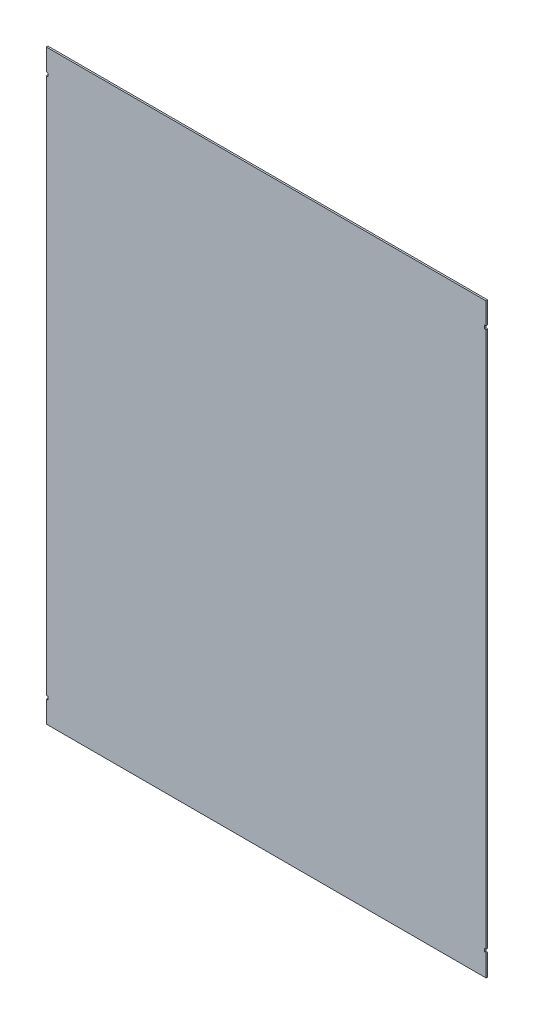
from build123d import *

# Parameters (mm, degrees)
SKETCH1_W               = 838.2
SKETCH1_H               = 1117.6
BOSS_EXTRUDE1_DEPTH     = 3.175
SKETCH3_W               = 3.175
SKETCH3_H               = 6.35
CUT_EXTRUDE2_DEPTH      = 25.4
MIRROR3_COPY_1_SKETCH_W = 3.175
MIRROR3_COPY_1_SKETCH_H = 6.35
MIRROR3_COPY_1_DEPTH    = 25.4


with BuildPart() as part:
    # Sketch1 → Boss-Extrude1 (new body)
    with BuildSketch(Plane.XY):
        with Locations((419.1, 558.8)):
            Rectangle(SKETCH1_W, SKETCH1_H)
    extrude(amount=BOSS_EXTRUDE1_DEPTH)

    # Sketch3 → Cut-Extrude2 (cut)
    with BuildSketch(Plane.XY.offset(3.175)):
        with Locations((1.5875, 1073.170453208)):
            Rectangle(SKETCH3_W, SKETCH3_H)
    cut_extrude2 = extrude(amount=-CUT_EXTRUDE2_DEPTH, mode=Mode.SUBTRACT)

    # Mirror1: Cut-Extrude2 across plane
    add(cut_extrude2.mirror(Plane.ZX.offset(558.8)), mode=Mode.SUBTRACT)

    # Mirror3: Cut-Extrude2 across plane
    add(cut_extrude2.mirror(Plane.ZY.offset(-419.1)), mode=Mode.SUBTRACT)

    # Mirror3 copy 1 sketch → Mirror3 copy 1 (cut)
    with BuildSketch(Plane(origin=(838.2, 1117.6, 3.175), x_dir=(-1, 0, 0), z_dir=(0, 0, 1))):
        with Locations((1.5875, 1073.170453208)):
            Rectangle(MIRROR3_COPY_1_SKETCH_W, MIRROR3_COPY_1_SKETCH_H)
    extrude(amount=-MIRROR3_COPY_1_DEPTH, mode=Mode.SUBTRACT)


solid = part.part
